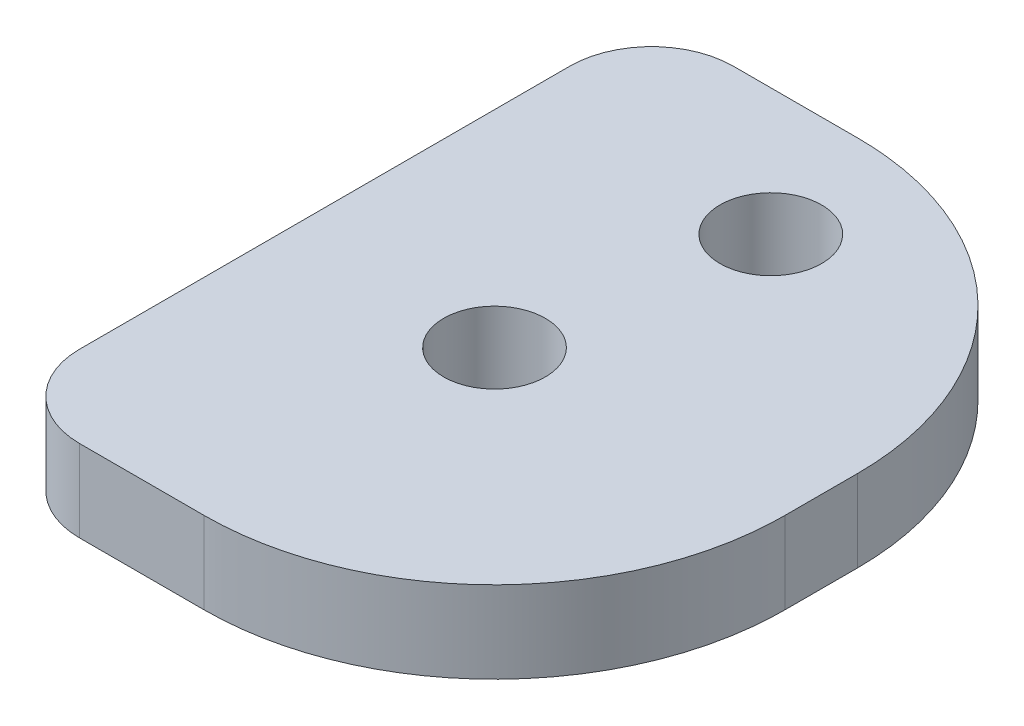
from build123d import *

# Parameters (mm, degrees)
SKETCH1_W           = 50.8
SKETCH1_H           = 22.86
BOSS_EXTRUDE1_DEPTH = 3.175
FILLET1_R           = 10.16
SKETCH3_R           = 1.778
CUT_EXTRUDE1_DEPTH  = 29.033649869
FILLET3_R           = 10.16
SCALE1_SCALE_X      = 1.11
SCALE1_SCALE_Y      = 1
SCALE1_SCALE_Z      = 1.11
SKETCH4_W           = 37.109402391
SKETCH4_H           = 25.3746
CUT_EXTRUDE2_DEPTH  = 32.108311229
FILLET4_R           = 3.175


with BuildPart() as part:
    # Sketch1 → Boss-Extrude1 (new body)
    with BuildSketch(Plane(origin=(0, 0, 0), x_dir=(1, 0, 0), z_dir=(0, 1, 0))):
        Rectangle(SKETCH1_W, SKETCH1_H)
    extrude(amount=BOSS_EXTRUDE1_DEPTH)

    # Fillet1
    fillet1_edges = [part.edges().sort_by_distance(p)[0] for p in [
        (25.4, 1.5875, 11.43),
        (-25.4, 1.5875, 11.43),
    ]]
    fillet(fillet1_edges, radius=FILLET1_R)

    # Sketch3 → Cut-Extrude1 (cut, through all)
    with BuildSketch(Plane(origin=(0, 3.175, 0), x_dir=(1, 0, 0), z_dir=(0, 1, 0))):
        with Locations(Location((15.24, -1.27, 0), (0, 0, 270))):
            Circle(SKETCH3_R)
        with Locations(Location((16.637, 6.994763457, 0), (0, 0, 270))):
            Circle(SKETCH3_R)
        with Locations(Location((-3.81, -1.27, 0), (0, 0, 270))):
            Circle(SKETCH3_R)
    extrude(amount=-CUT_EXTRUDE1_DEPTH, mode=Mode.SUBTRACT)

    # Fillet3
    fillet3_edges = [part.edges().sort_by_distance(p)[0] for p in [
        (-25.4, 1.5875, -11.43),
        (25.4, 1.5875, -11.43),
    ]]
    fillet(fillet3_edges, radius=FILLET3_R)


with BuildPart() as part_1:
    # Scale1: scaled about (-0.267284258, 1.5875, 0.042423064)
    add(part.part.scale((SCALE1_SCALE_X, SCALE1_SCALE_Y, SCALE1_SCALE_Z), about=(-0.267284258, 1.5875, 0.042423064)))

    # Sketch4 → Cut-Extrude2 (cut, through all)
    with BuildSketch(Plane(origin=(0, 3.175, 0), x_dir=(1, 0, 0), z_dir=(0, 1, 0))):
        with Locations((-9.609897537, 0.004666537)):
            Rectangle(SKETCH4_W, SKETCH4_H)
    extrude(amount=-CUT_EXTRUDE2_DEPTH, mode=Mode.SUBTRACT)

    # Fillet4
    fillet4_edges = [part_1.edges().sort_by_distance(p)[0] for p in [
        (8.944803659, 1.5875, 12.682633463),
        (8.944803659, 1.5875, -12.691966537),
    ]]
    fillet(fillet4_edges, radius=FILLET4_R)


solid = part_1.part
